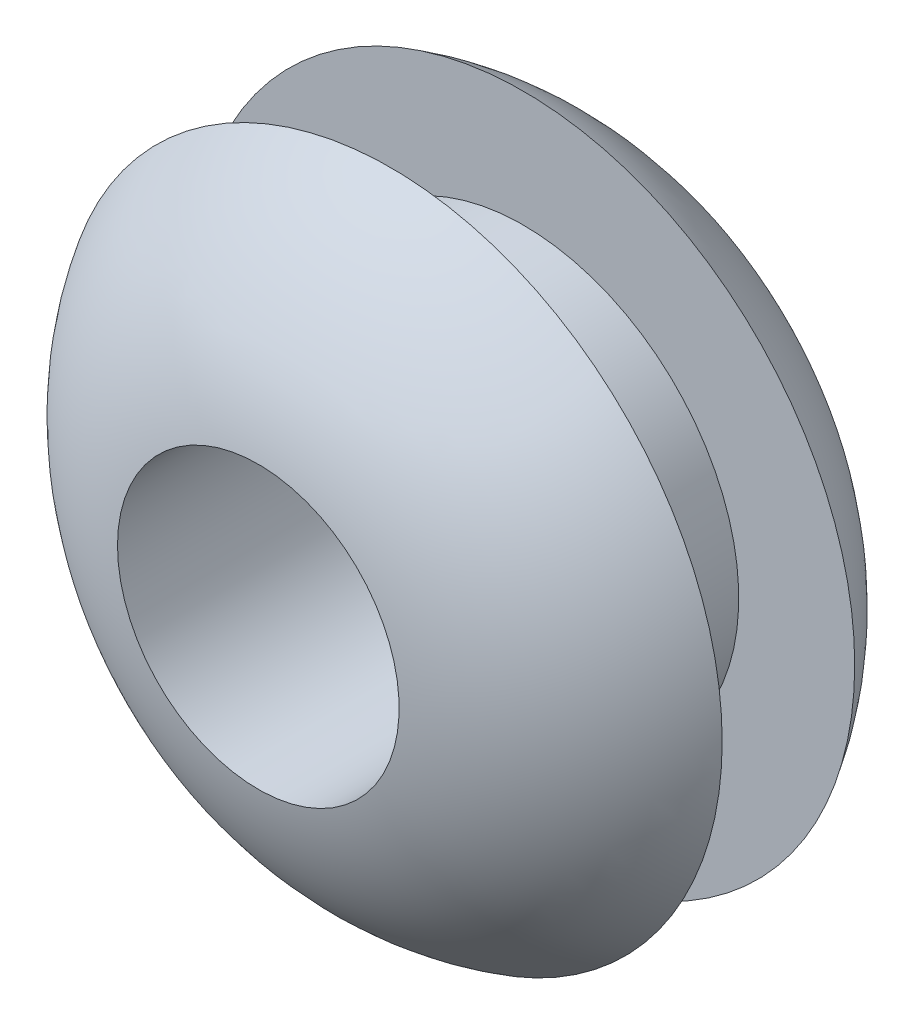
from build123d import *


with BuildPart() as part:
    # Эскиз1 → Повернуть1 (revolve)
    with BuildSketch(Plane(origin=(0, 0, 0), x_dir=(0, 0, -1), z_dir=(1, 0, 0)), mode=Mode.PRIVATE) as revolve_1_sk:
        with BuildLine():
            Line((-4.329065482, 3.3734375), (-13.854065482, 3.3734375))
            ThreePointArc((-13.854065482, 3.3734375), (-12.765956247, 6.002871022), (-10.679065482, 7.9375))
            Line((-10.679065482, 7.9375), (-10.679065482, 5.159375))
            Line((-10.679065482, 5.159375), (-7.504065482, 5.159375))
            Line((-7.504065482, 5.159375), (-7.504065482, 7.9375))
            ThreePointArc((-7.504065482, 7.9375), (-5.417174717, 6.002871022), (-4.329065482, 3.3734375))
        make_face()
    revolve(revolve_1_sk.sketch.rotate(Axis((0, 0, 0), (0, 0, 1)), 90), axis=Axis((0, 0, 0), (0, 0, 1)))


solid = part.part
